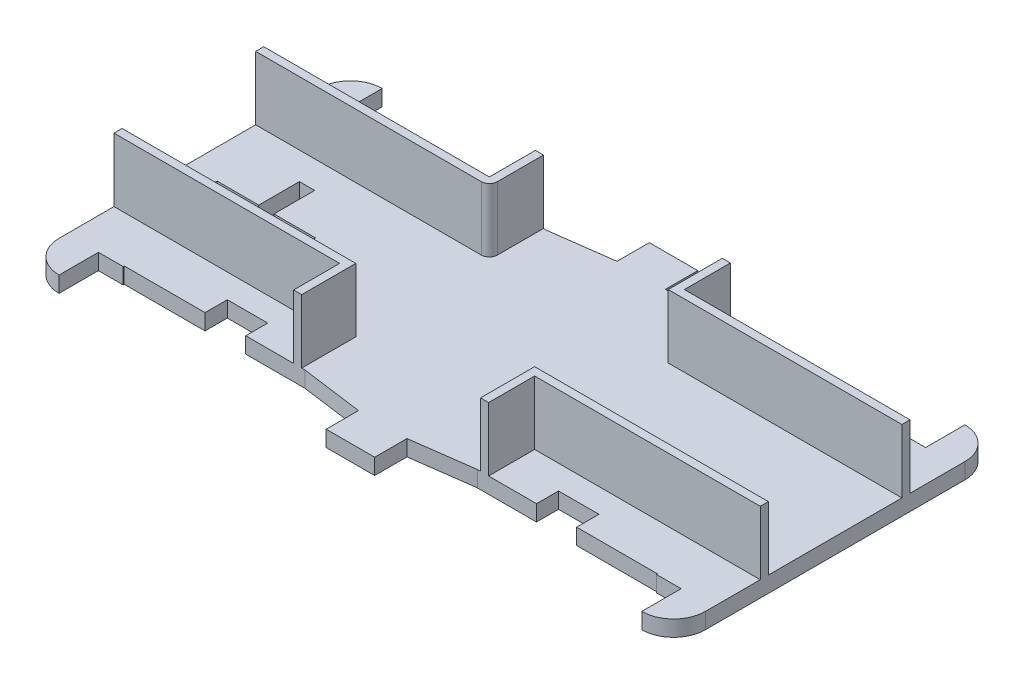
from build123d import *

# Parameters (mm, degrees)
SKETCH1_W                                = 203.2
SKETCH1_H                                = 101.6
BOSS_EXTRUDE1_DEPTH                      = 5
CUT_EXTRUDE1_DEPTH                       = 114.702242722
MIRROR3_COPY_1_DEPTH                     = 114.702242722
MIRROR3_COPY_2_DEPTH                     = 114.702242722
MIRROR3_AT_THE_SECOND_PLANE_COPY_1_DEPTH = 114.702242722
MIRROR3_AT_THE_SECOND_PLANE_COPY_2_DEPTH = 114.702242722
FILLET1_R                                = 10
CUT_EXTRUDE4_DEPTH                       = 114.702242722
EXTRUDE_THIN2_DEPTH                      = 20
FILLET2_R                                = 2.54
MIRROR5_COPY_1_DEPTH                     = 20
SKETCH6_W                                = 7.78
SKETCH6_H                                = 12.370322326
CUT_EXTRUDE5_DEPTH                       = 116.339498872
MIRROR7_COPY_1_SKETCH_W                  = 7.78
MIRROR7_COPY_1_SKETCH_H                  = 12.370322326
MIRROR7_COPY_1_DEPTH                     = 116.339498872


with BuildPart() as part:
    # Sketch1 → Boss-Extrude1 (new body)
    with BuildSketch(Plane(origin=(0, 0, 0), x_dir=(1, 0, 0), z_dir=(0, 1, 0))):
        Rectangle(SKETCH1_W, SKETCH1_H)
    extrude(amount=BOSS_EXTRUDE1_DEPTH)

    # Sketch2 → Cut-Extrude1 (cut, through all)
    with BuildSketch(Plane(origin=(0, 5, 0), x_dir=(1, 0, 0), z_dir=(0, 1, 0))):
        Polygon((-83.82, 50.8), (-83.82, 38.1), (-58.42, 38.1), (-58.42, 31.092879285), (-45.72, 31.092879285), (-45.72, 38.012329732), (-27.10855449, 38.012329732), (-7.62, 40.64), (-7.62, 50.8), (-7.62, 63.5), (-83.82, 63.5), align=None)
    cut_extrude1 = extrude(amount=-CUT_EXTRUDE1_DEPTH, mode=Mode.SUBTRACT)

    # Mirror2: Cut-Extrude1 across plane
    add(cut_extrude1.mirror(Plane.XY), mode=Mode.SUBTRACT)

    # Mirror3 copy 1 sketch → Mirror3 copy 1 (cut, through all)
    with BuildSketch(Plane(origin=(0, 5, 0), x_dir=(-1, 0, 0), z_dir=(0, 1, 0))):
        Polygon((-83.82, 50.8), (-83.82, 38.1), (-58.42, 38.1), (-58.42, 31.092879285), (-45.72, 31.092879285), (-45.72, 38.012329732), (-27.10855449, 38.012329732), (-7.62, 40.64), (-7.62, 50.8), (-7.62, 63.5), (-83.82, 63.5), align=None)
    extrude(amount=-MIRROR3_COPY_1_DEPTH, mode=Mode.SUBTRACT)

    # Mirror3 copy 2 sketch → Mirror3 copy 2 (cut, through all)
    with BuildSketch(Plane(origin=(0, 5, 0), x_dir=(-1, 0, 0), z_dir=(0, 1, 0))):
        Polygon((-83.82, -50.8), (-83.82, -38.1), (-58.42, -38.1), (-58.42, -31.092879285), (-45.72, -31.092879285), (-45.72, -38.012329732), (-27.10855449, -38.012329732), (-7.62, -40.64), (-7.62, -50.8), (-7.62, -63.5), (-83.82, -63.5), align=None)
    extrude(amount=-MIRROR3_COPY_2_DEPTH, mode=Mode.SUBTRACT)

    # Mirror3 at the second plane copy 1 sketc → Mirror3 at the second plane copy 1 (cut, through all)
    with BuildSketch(Plane.XZ.offset(5)):
        Polygon((-83.82, 50.8), (-83.82, 38.1), (-58.42, 38.1), (-58.42, 31.092879285), (-45.72, 31.092879285), (-45.72, 38.012329732), (-27.10855449, 38.012329732), (-7.62, 40.64), (-7.62, 50.8), (-7.62, 63.5), (-83.82, 63.5), align=None)
    extrude(amount=-MIRROR3_AT_THE_SECOND_PLANE_COPY_1_DEPTH, mode=Mode.SUBTRACT)

    # Mirror3 at the second plane copy 2 sketc → Mirror3 at the second plane copy 2 (cut, through all)
    with BuildSketch(Plane.XZ.offset(5)):
        Polygon((-83.82, -50.8), (-83.82, -38.1), (-58.42, -38.1), (-58.42, -31.092879285), (-45.72, -31.092879285), (-45.72, -38.012329732), (-27.10855449, -38.012329732), (-7.62, -40.64), (-7.62, -50.8), (-7.62, -63.5), (-83.82, -63.5), align=None)
    extrude(amount=-MIRROR3_AT_THE_SECOND_PLANE_COPY_2_DEPTH, mode=Mode.SUBTRACT)

    # Fillet1
    fillet1_edges = [part.edges().sort_by_distance(p)[0] for p in [
        (-101.6, 2.5, -50.8),
        (101.6, 2.5, -50.8),
        (101.6, 2.5, 50.8),
        (-101.6, 2.5, 50.8),
    ]]
    fillet(fillet1_edges, radius=FILLET1_R)

    # Sketch4 → Cut-Extrude4 (cut, through all)
    with BuildSketch(Plane(origin=(0, 5, 0), x_dir=(1, 0, 0), z_dir=(0, 1, 0))):
        Polygon((-79.253566692, -0.386186374), (-92.330677874, -0.386186374), (-92.330677874, -5.264279815), (-79.253566692, -5.264279815), (-79.253566692, -18.065233094), (-74.450657601, -18.065233094), (-74.450657601, -5.264279815), (-61.373546419, -5.264279815), (-61.373546419, -0.386186374), (-74.450657601, -0.386186374), (-74.450657601, 12.414766906), (-79.253566692, 12.414766906), align=None)
    extrude(amount=-CUT_EXTRUDE4_DEPTH, mode=Mode.SUBTRACT)

    # Sketch5 → Extrude-Thin2 (add)
    with BuildSketch(Plane(origin=(0, 5, 0), x_dir=(1, 0, 0), z_dir=(0, 1, 0))):
        Polygon((-101.6, 23.539546153), (-30.65615313, 23.539546153), (-30.65615313, 38.012329732), (-28.11615313, 38.012329732), (-28.11615313, 20.999546153), (-101.6, 20.999546153), align=None)
    extrude_thin2 = extrude(amount=EXTRUDE_THIN2_DEPTH)

    # Fillet2
    fillet2_edges = [part.edges().sort_by_distance(p)[0] for p in [
        (-28.11615313, 15, -20.999546153),
    ]]
    fillet(fillet2_edges, radius=FILLET2_R)

    # Mirror4: Extrude-Thin2 across plane
    add(extrude_thin2.mirror(Plane.XY))

    # Mirror5: Extrude-Thin2 across plane
    add(extrude_thin2.mirror(Plane(origin=(0, 0, 0), x_dir=(0, 0, 1), z_dir=(1, 0, 0))))

    # Mirror5 copy 1 sketch → Mirror5 copy 1 (add)
    with BuildSketch(Plane(origin=(0, 5, 0), x_dir=(-1, 0, 0), z_dir=(0, 1, 0))):
        Polygon((-101.6, 23.539546153), (-30.65615313, 23.539546153), (-30.65615313, 38.012329732), (-28.11615313, 38.012329732), (-28.11615313, 20.999546153), (-101.6, 20.999546153), align=None)
    extrude(amount=MIRROR5_COPY_1_DEPTH)

    # Sketch6 → Cut-Extrude5 (cut, through all)
    with BuildSketch(Plane(origin=(0, 5, 0), x_dir=(1, 0, 0), z_dir=(0, 1, 0))):
        with Locations((-87.71, 44.614838837)):
            Rectangle(SKETCH6_W, SKETCH6_H)
    cut_extrude5 = extrude(amount=-CUT_EXTRUDE5_DEPTH, mode=Mode.SUBTRACT)

    # Mirror6: Cut-Extrude5 across plane
    add(cut_extrude5.mirror(Plane.XY), mode=Mode.SUBTRACT)

    # Mirror7: Cut-Extrude5 across plane
    add(cut_extrude5.mirror(Plane(origin=(0, 0, 0), x_dir=(0, 0, 1), z_dir=(1, 0, 0))), mode=Mode.SUBTRACT)

    # Mirror7 copy 1 sketch → Mirror7 copy 1 (cut, through all)
    with BuildSketch(Plane(origin=(0, 5, 0), x_dir=(-1, 0, 0), z_dir=(0, 1, 0))):
        with Locations((-87.71, 44.614838837)):
            Rectangle(MIRROR7_COPY_1_SKETCH_W, MIRROR7_COPY_1_SKETCH_H)
    extrude(amount=-MIRROR7_COPY_1_DEPTH, mode=Mode.SUBTRACT)


solid = part.part
